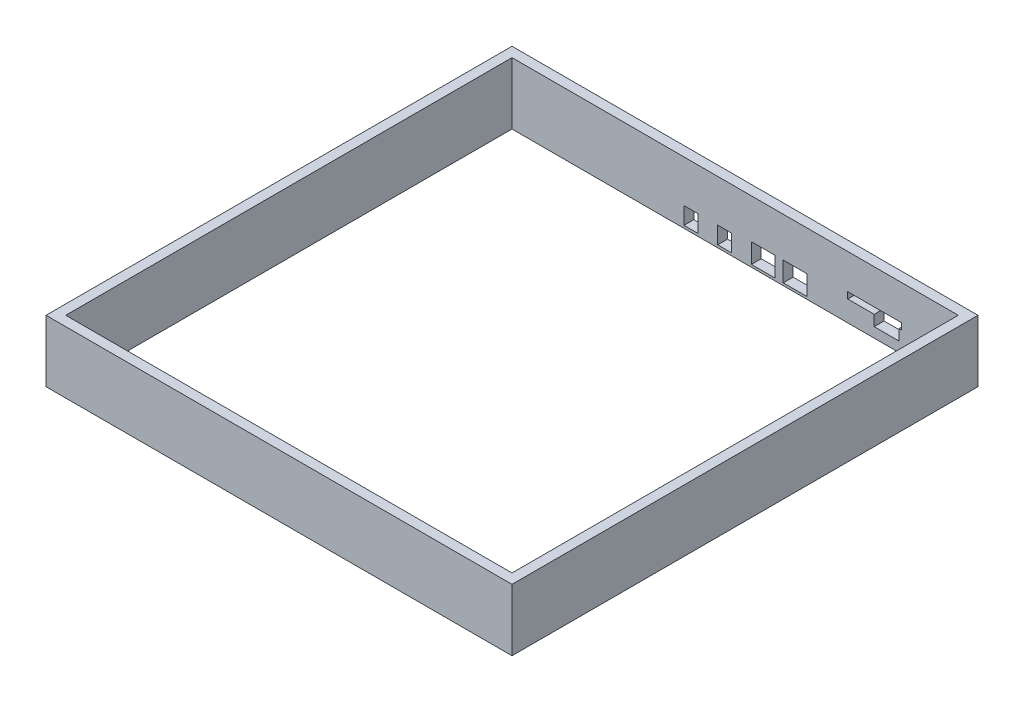
from build123d import *

# Parameters (mm, degrees)
SKETCH1_W           = 300
SKETCH1_H           = 300
SKETCH1_W_2         = 287.3
SKETCH1_H_2         = 287.3
BOSS_EXTRUDE1_DEPTH = 39.8272
CUT_EXTRUDE1_REACH  = 339.766
SKETCH3_W           = 15.3
SKETCH3_H           = 12.7
SKETCH3_W_2         = 9
SKETCH3_H_2         = 11


with BuildPart() as part:
    # Sketch1 → Boss-Extrude1 (new body)
    with BuildSketch(Plane(origin=(0, 0, 0), x_dir=(1, 0, 0), z_dir=(0, 1, 0))):
        Rectangle(SKETCH1_W, SKETCH1_H)
        Rectangle(SKETCH1_W_2, SKETCH1_H_2, mode=Mode.SUBTRACT)
    extrude(amount=BOSS_EXTRUDE1_DEPTH)

    # Sketch3 → Cut-Extrude1 (cut, up to next)
    with BuildSketch(Plane(origin=(0, 0, -150), x_dir=(-1, 0, 0), z_dir=(0, 0, -1)), mode=Mode.PRIVATE) as cut_extrude1_sk1:
        Polygon((-72.497624126, 13.305953258), (-72.497624126, 17.418810742), (-107.152019667, 17.418810742), (-107.152019667, 13.305953258), (-105.517624126, 13.305953258), (-105.517624126, 6.4008), (-89.515624126, 6.4008), (-89.515624126, 13.305953258), align=None)
    cut_extrude1_tool1 = extrude(cut_extrude1_sk1.sketch, amount=-CUT_EXTRUDE1_REACH, mode=Mode.PRIVATE) & part.part
    # Sketch3 → Cut-Extrude1 (cut, up to next)
    with BuildSketch(Plane(origin=(0, 0, -150), x_dir=(-1, 0, 0), z_dir=(0, 0, -1)), mode=Mode.PRIVATE) as cut_extrude1_sk2:
        with Locations((-38.618448478, 7.9248)):
            Rectangle(SKETCH3_W, SKETCH3_H)
    cut_extrude1_tool2 = extrude(cut_extrude1_sk2.sketch, amount=-CUT_EXTRUDE1_REACH, mode=Mode.PRIVATE) & part.part
    # Sketch3 → Cut-Extrude1 (cut, up to next)
    with BuildSketch(Plane(origin=(0, 0, -150), x_dir=(-1, 0, 0), z_dir=(0, 0, -1)), mode=Mode.PRIVATE) as cut_extrude1_sk3:
        with Locations((-18.092571078, 7.9248)):
            Rectangle(SKETCH3_W, SKETCH3_H)
    cut_extrude1_tool3 = extrude(cut_extrude1_sk3.sketch, amount=-CUT_EXTRUDE1_REACH, mode=Mode.PRIVATE) & part.part
    # Sketch3 → Cut-Extrude1 (cut, up to next)
    with BuildSketch(Plane(origin=(0, 0, -150), x_dir=(-1, 0, 0), z_dir=(0, 0, -1)), mode=Mode.PRIVATE) as cut_extrude1_sk4:
        with Locations((6.757428922, 7.1748)):
            Rectangle(SKETCH3_W_2, SKETCH3_H_2)
    cut_extrude1_tool4 = extrude(cut_extrude1_sk4.sketch, amount=-CUT_EXTRUDE1_REACH, mode=Mode.PRIVATE) & part.part
    # Sketch3 → Cut-Extrude1 (cut, up to next)
    with BuildSketch(Plane(origin=(0, 0, -150), x_dir=(-1, 0, 0), z_dir=(0, 0, -1)), mode=Mode.PRIVATE) as cut_extrude1_sk5:
        with Locations((28.457428922, 7.1748)):
            Rectangle(SKETCH3_W_2, SKETCH3_H_2)
    cut_extrude1_tool5 = extrude(cut_extrude1_sk5.sketch, amount=-CUT_EXTRUDE1_REACH, mode=Mode.PRIVATE) & part.part
    add(cut_extrude1_tool1.solids().sort_by_distance((93.183841, 12.956593, -150))[0], mode=Mode.SUBTRACT)
    add(cut_extrude1_tool2.solids().sort_by_distance((38.618448, 7.9248, -150))[0], mode=Mode.SUBTRACT)
    add(cut_extrude1_tool3.solids().sort_by_distance((18.092571, 7.9248, -150))[0], mode=Mode.SUBTRACT)
    add(cut_extrude1_tool4.solids().sort_by_distance((-6.757429, 7.1748, -150))[0], mode=Mode.SUBTRACT)
    add(cut_extrude1_tool5.solids().sort_by_distance((-28.457429, 7.1748, -150))[0], mode=Mode.SUBTRACT)


solid = part.part
